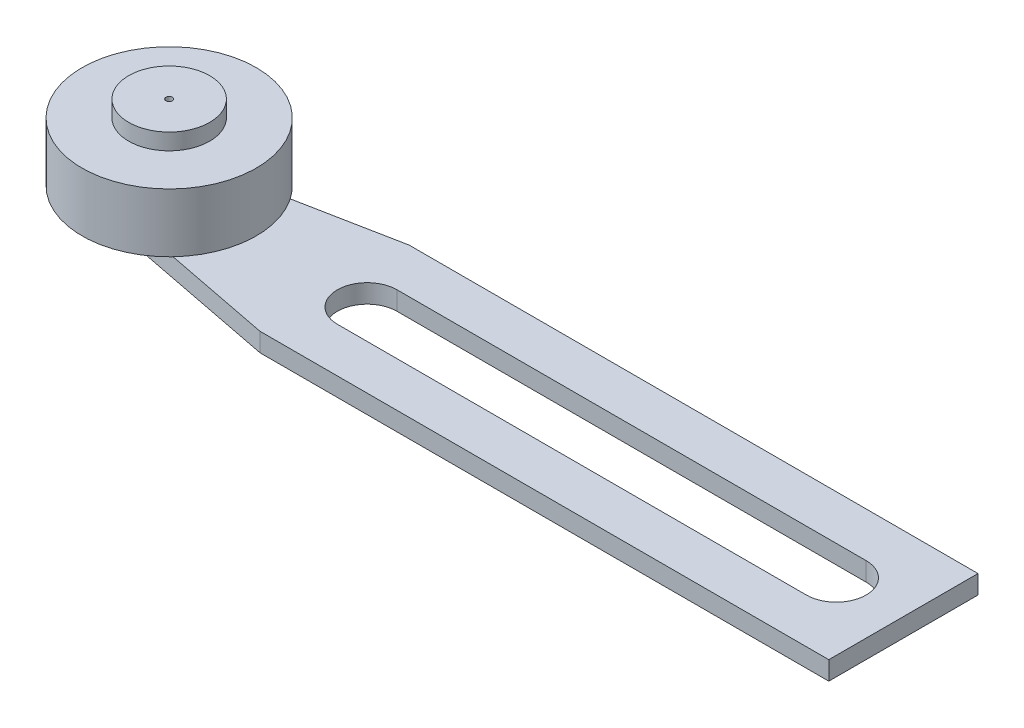
from build123d import *

# Parameters (mm, degrees)
EXTRUDE1_DEPTH = 2


with BuildPart() as part:
    # Sketch1 → Extrude1 (new body)
    with BuildSketch(Plane(origin=(0, 0, 0), x_dir=(1, 0, 0), z_dir=(0, 1, 0))):
        with BuildLine():
            Line((-61, 8), (0, 8))
            Line((0, 8), (0, -8))
            Line((0, -8), (-61, -8))
            Line((-61, -8), (-79.361011839, -4.418933189))
            ThreePointArc((-79.361011839, -4.418933189), (-82.999578751, -0.002663498), (-79.362010432, 4.414428743))
            Line((-79.362010432, 4.414428743), (-61, 8))
        make_face()
        with BuildLine():
            Line((-57.5, 3.2), (-7.2, 3.2))
            ThreePointArc((-7.2, 3.2), (-4, 0), (-7.2, -3.2))
            Line((-7.2, -3.2), (-57.5, -3.2))
            ThreePointArc((-57.5, -3.2), (-60.7, 0), (-57.5, 3.2))
        make_face(mode=Mode.SUBTRACT)
    extrude(amount=EXTRUDE1_DEPTH)


with BuildPart() as body_2:
    # Sketch2 → Revolve1 (revolve)
    with BuildSketch(Plane.XY, mode=Mode.PRIVATE) as revolve1_sk:
        Polygon((-76.392872799, 0), (-75.842872799, 0), (-75.842872799, -1.3), (-78.392872799, -1.3), (-78.392872799, 10.7), (-74.392872799, 10.7), (-74.392872799, 8.95), (-69.392872799, 8.95), (-69.392872799, 2.65), (-75.009396698, 2.65), (-75.009396698, 2), (-76.392872799, 2), align=None)
    revolve(revolve1_sk.sketch.rotate(Axis((-78.734267231, 1.065940946, 0), (0, 1, 0)), 90), axis=Axis((-78.734267231, 1.065940946, 0), (0, 1, 0)))


solid = Compound([part.part, body_2.part])
